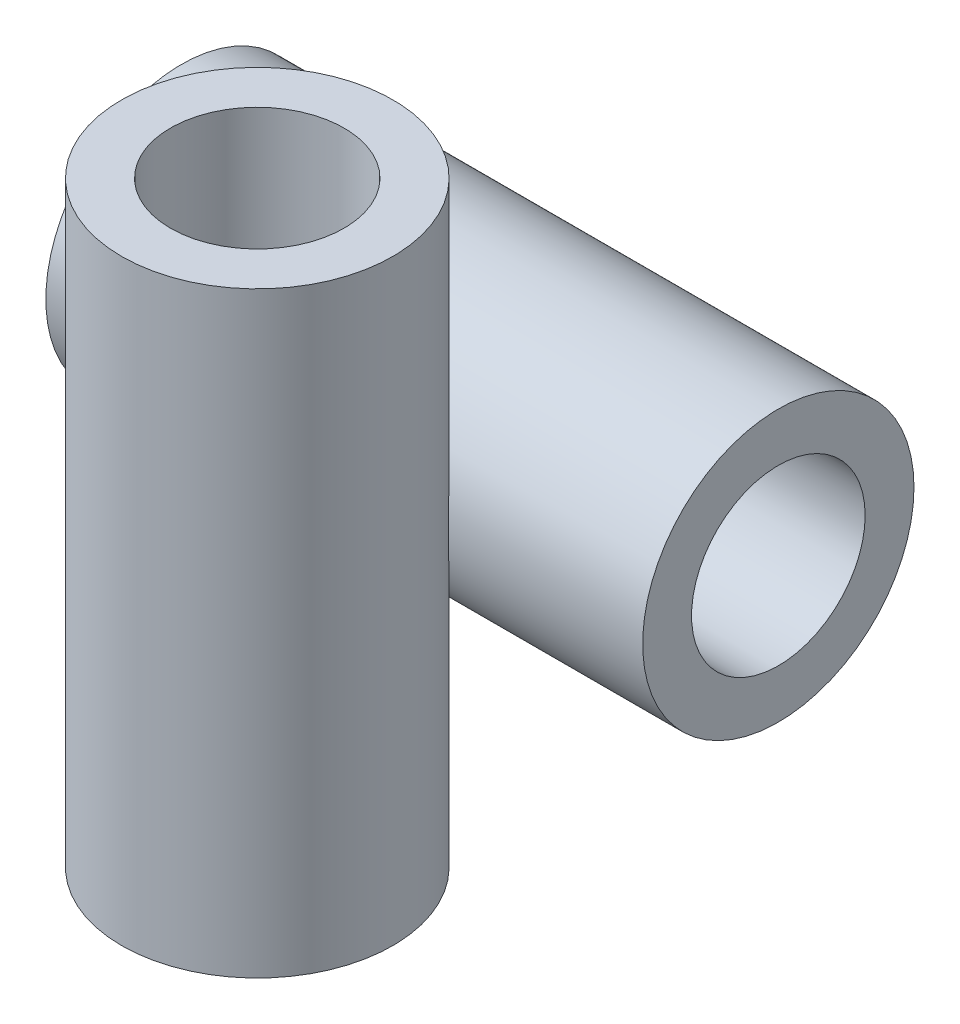
from build123d import *

# Parameters (mm, degrees)
SKETCH2_R                = 25
SKETCH2_R_2              = 16
BOSS_EXTRUDE1_DEPTH      = 110
BOSS_EXTRUDE3_DEPTH      = 55
BOSS_EXTRUDE3_DEPTH_BACK = 55
SKETCH3_R                = 25
SKETCH5_R                = 16
CUT_EXTRUDE2_DEPTH       = 110


with BuildPart() as part:
    # Sketch2 → Boss-Extrude1 (new body)
    with BuildSketch(Plane(origin=(0, 0, 0), x_dir=(1, 0, 0), z_dir=(0, 1, 0))):
        Circle(SKETCH2_R)
        Circle(SKETCH2_R_2, mode=Mode.SUBTRACT)
    extrude(amount=BOSS_EXTRUDE1_DEPTH)

    # Sketch3 → Boss-Extrude3 (add, two sides: drawn at the far end of the back side and taken through both)
    with BuildSketch(Plane(origin=(0, 0, 0), x_dir=(0, 0, -1), z_dir=(1, 0, 0)).offset(-BOSS_EXTRUDE3_DEPTH_BACK)):
        with Locations((41.031680292, 55.145345171)):
            Circle(SKETCH3_R)
    extrude(amount=BOSS_EXTRUDE3_DEPTH + BOSS_EXTRUDE3_DEPTH_BACK)

    # Sketch5 → Cut-Extrude2 (cut)
    with BuildSketch(Plane(origin=(55, 0, 0), x_dir=(0, 0, -1), z_dir=(1, 0, 0))):
        with Locations((41.031680292, 55.145345171)):
            Circle(SKETCH5_R)
    extrude(amount=-CUT_EXTRUDE2_DEPTH, mode=Mode.SUBTRACT)


solid = part.part
